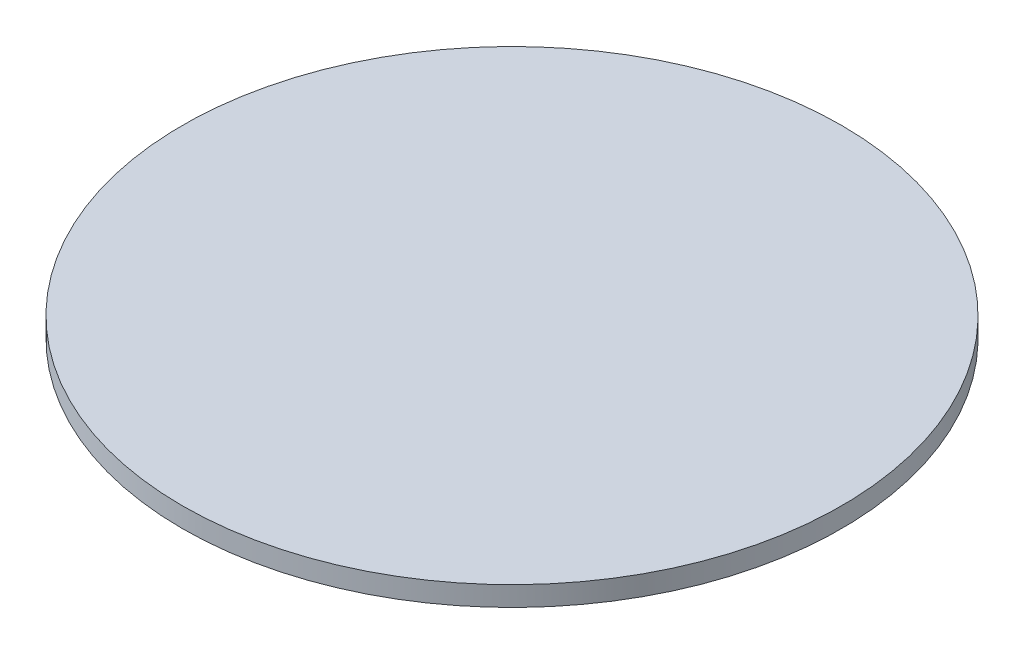
from build123d import *

# Parameters (mm, degrees)
SKETCH1_R           = 50
BOSS_EXTRUDE1_DEPTH = 3


with BuildPart() as part:
    # Sketch1 → Boss-Extrude1 (new body)
    with BuildSketch(Plane(origin=(0, 0, 0), x_dir=(1, 0, 0), z_dir=(0, 1, 0))):
        with Locations(Location((0, 0, 0), (0, 0, 270))):
            Circle(SKETCH1_R)
    extrude(amount=BOSS_EXTRUDE1_DEPTH)


solid = part.part
